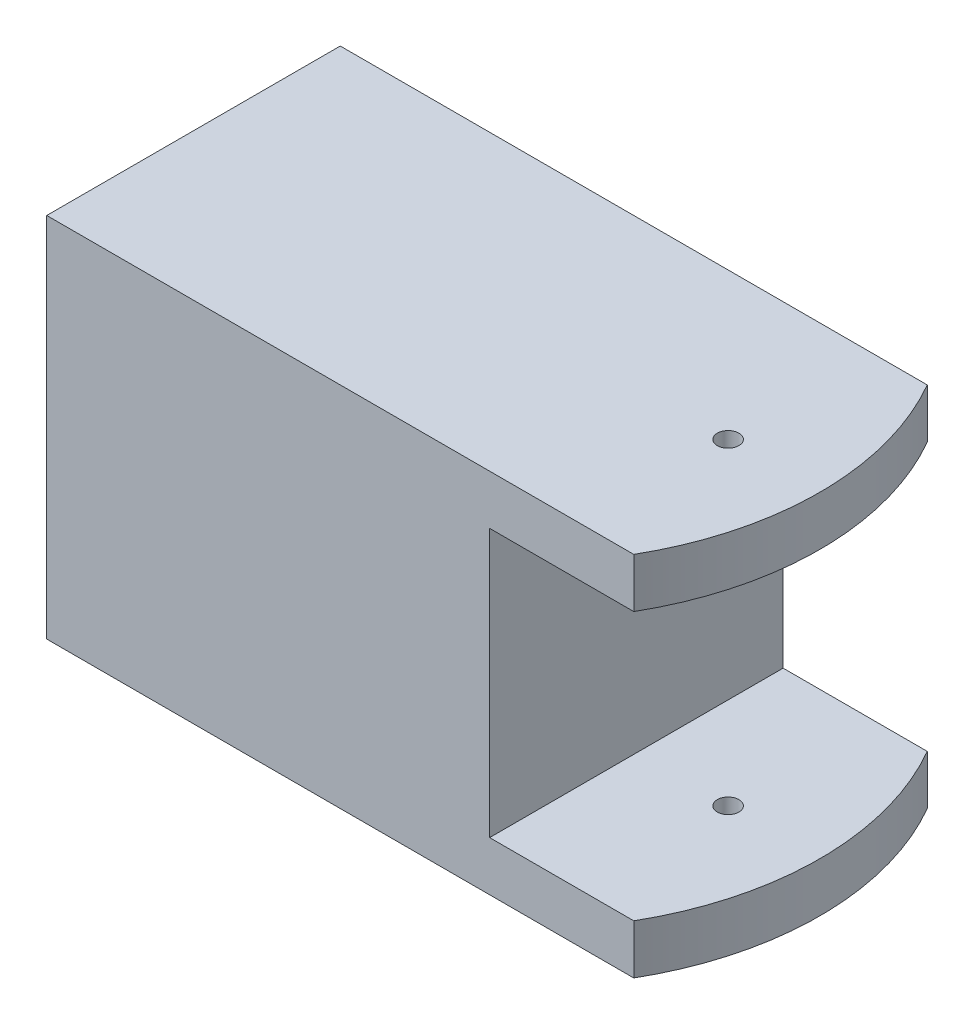
from build123d import *

# Parameters (mm, degrees)
BOSS_EXTRUDE1_DEPTH      = 25
BOSS_EXTRUDE1_DEPTH_BACK = 25
CUT_EXTRUDE2_DEPTH       = 87.168439698
CUT_EXTRUDE2_DEPTH_BACK  = 87.168439698
SKETCH3_W                = 27.604398764
SKETCH3_H                = 36.5
CUT_EXTRUDE3_DEPTH       = 87.168439698
CUT_EXTRUDE3_DEPTH_BACK  = 87.168439698
SKETCH4_R                = 1.47496879


with BuildPart() as part:
    # Sketch1 → Boss-Extrude1 (new, two sides: drawn at the far end of the back side and taken through both)
    with BuildSketch(Plane(origin=(0, 0, 0), x_dir=(1, 0, 0), z_dir=(0, 1, 0)).offset(-BOSS_EXTRUDE1_DEPTH_BACK)):
        with BuildLine():
            Line((0, -20), (-80, -20))
            Line((-80, -20), (-80, 20))
            Line((-80, 20), (0, 20))
            ThreePointArc((0, 20), (5.358983849, 0), (0, -20))
        make_face()
    extrude(amount=BOSS_EXTRUDE1_DEPTH + BOSS_EXTRUDE1_DEPTH_BACK)

    # Sketch3 → Cut-Extrude2 (cut, two sides: drawn at the far end of the back side and taken through both)
    with BuildSketch(Plane.XY.offset(-CUT_EXTRUDE2_DEPTH_BACK)):
        with Locations((-5.838816769, 0)):
            Rectangle(SKETCH3_W, SKETCH3_H)
    extrude(amount=CUT_EXTRUDE2_DEPTH + CUT_EXTRUDE2_DEPTH_BACK, mode=Mode.SUBTRACT)

    # Sketch4 → Cut-Extrude3 (cut, two sides: drawn at the far end of the back side and taken through both)
    with BuildSketch(Plane(origin=(0, 0, 0), x_dir=(1, 0, 0), z_dir=(0, 1, 0)).offset(-CUT_EXTRUDE3_DEPTH_BACK)):
        with Locations((-7.141016151, 0)):
            Circle(SKETCH4_R)
    extrude(amount=CUT_EXTRUDE3_DEPTH + CUT_EXTRUDE3_DEPTH_BACK, mode=Mode.SUBTRACT)


solid = part.part
